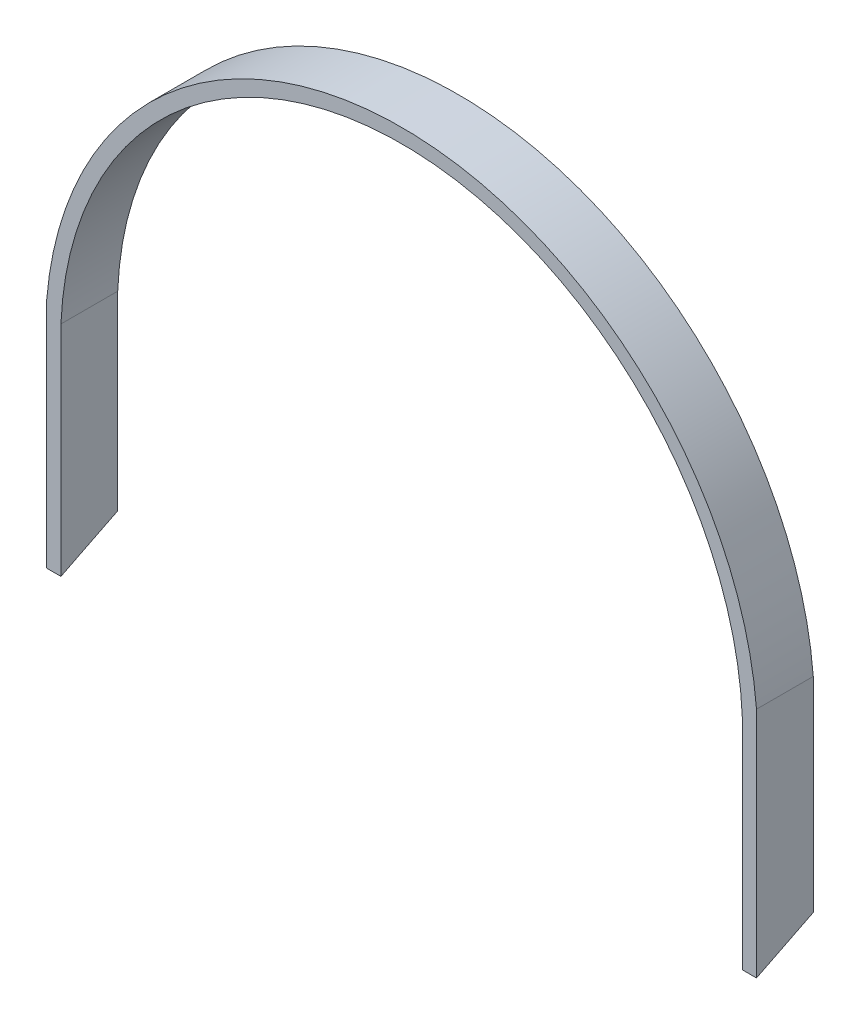
from build123d import *

# Parameters (mm, degrees)
BOSS_EXTRU_1_DEPTH      = 20
ENL_V_MAT_EXTRU_1_DEPTH = 319.918484883


with BuildPart() as part:
    # Esquisse1 → Boss.-Extru.1 (new body)
    with BuildSketch(Plane.XY):
        with BuildLine():
            Line((5, 0), (5, 77))
            ThreePointArc((5, 77), (125, 192), (245, 77))
            Line((245, 77), (245, 0))
            Line((245, 0), (250, 0))
            Line((250, 0), (250, 82))
            ThreePointArc((250, 82), (125, 197), (0, 82))
            Line((0, 82), (0, 0))
            Line((0, 0), (5, 0))
        make_face()
    extrude(amount=BOSS_EXTRU_1_DEPTH)

    # Esquisse2 → Enlèv. mat.-Extru.1 (cut, through all)
    with BuildSketch(Plane(origin=(250, 0, 0), x_dir=(0, 0, -1), z_dir=(1, 0, 0))):
        Polygon((-20, 0), (0, 0), (0, 10), align=None)
    extrude(amount=-ENL_V_MAT_EXTRU_1_DEPTH, mode=Mode.SUBTRACT)


solid = part.part
